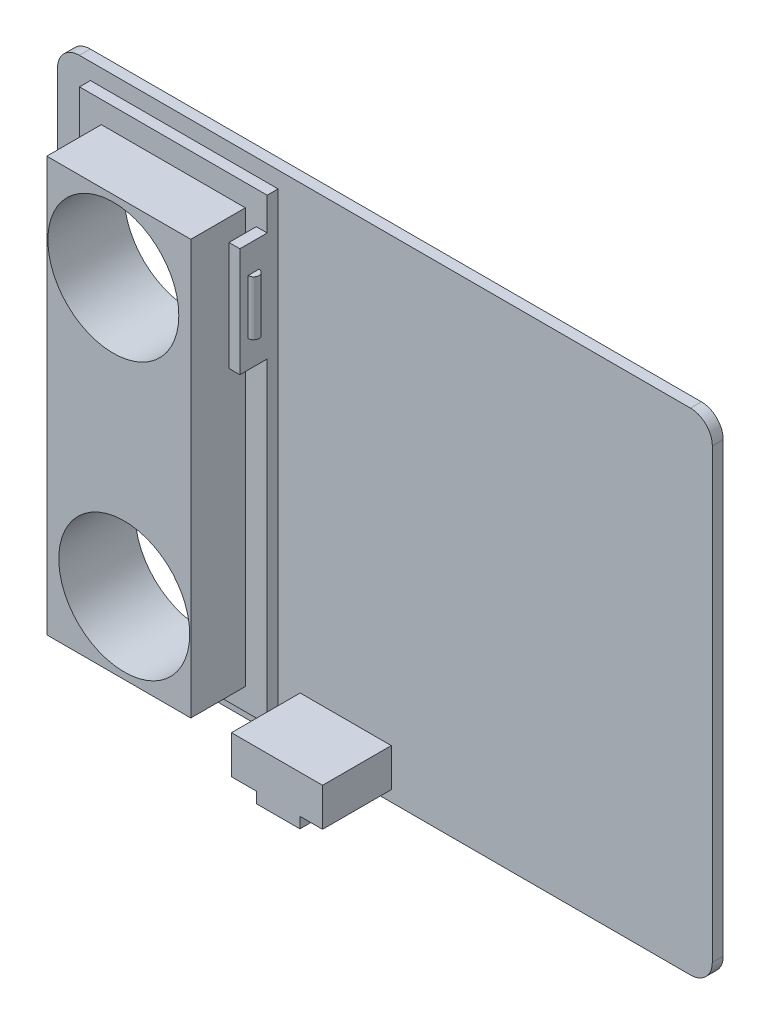
from build123d import *

# Parameters (mm, degrees)
SKETCH_1_W           = 17.2
SKETCH_1_H           = 42
SKETCH_1_W_2         = 13.2
SKETCH_1_H_2         = 38
EXTRUDE_1_DEPTH      = 1
SKETCH_2_W           = 1
SKETCH_2_H           = 10
EXTRUDE_2_DEPTH      = 2.5
EXTRUDE_3_DEPTH      = 2.5
EXTRUDE_3_DEPTH_BACK = 2.5
EXTRUDE_4_DEPTH      = 2.5
EXTRUDE_4_DEPTH_BACK = 2.5
SKETCH_5_W           = 60.014732212
SKETCH_5_H           = 45
EXTRUDE_5_DEPTH      = 1
FILLET_1_R           = 2
SKETCH_6_W           = 8.55
SKETCH_6_H           = 3.5
EXTRUDE_6_DEPTH      = 6.3
SKETCH_7_W           = 3.972075094
SKETCH_7_H           = 1
EXTRUDE_7_DEPTH      = 6.3
SKETCH_8_R           = 6
CUT_EXTRUDE_1_DEPTH  = 72.978746863
EXTRUDE_START        = 6
SKETCH_9_W           = 13.2
SKETCH_9_H           = 38
SKETCH_9_R           = 6
EXTRUDE_8_DEPTH      = 6
FILLET_2_R           = 0.15
SKETCH_10_W          = 6.3
SKETCH_10_H          = 3.5
CUT_EXTRUDE_2_DEPTH  = 0.2


with BuildPart() as part:
    # 草图1 → 凸台-拉伸1 (new body)
    with BuildSketch(Plane.XY):
        with Locations((8.6, 21)):
            Rectangle(SKETCH_1_W, SKETCH_1_H)
        with Locations((8.6, 21)):
            Rectangle(SKETCH_1_W_2, SKETCH_1_H_2, mode=Mode.SUBTRACT)
    extrude(amount=EXTRUDE_1_DEPTH)

    # 草图2 → 凸台-拉伸2 (add)
    with BuildSketch(Plane.XY.offset(1)):
        with Locations((16.7, 34)):
            Rectangle(SKETCH_2_W, SKETCH_2_H)
        with Locations((0.5, 8)):
            Rectangle(SKETCH_2_W, SKETCH_2_H)
    extrude(amount=EXTRUDE_2_DEPTH)

    # 草图3 → 凸台-拉伸3 (add, two sides: drawn at the far end of the back side and taken through both)
    with BuildSketch(Plane(origin=(0, 34, 0), x_dir=(-1, 0, 0), z_dir=(0, -1, 0)).offset(-EXTRUDE_3_DEPTH_BACK)):
        with BuildLine():
            Line((-17.2, -1.75), (-17.2, -2.75))
            ThreePointArc((-17.2, -2.75), (-17.7, -2.25), (-17.2, -1.75))
        make_face()
    extrude(amount=EXTRUDE_3_DEPTH + EXTRUDE_3_DEPTH_BACK)

    # 草图4 → 凸台-拉伸4 (add, two sides: drawn at the far end of the back side and taken through both)
    with BuildSketch(Plane(origin=(0, 8, 0), x_dir=(-1, 0, 0), z_dir=(0, -1, 0)).offset(-EXTRUDE_4_DEPTH_BACK)):
        with BuildLine():
            Line((0, -1.75), (0, -2.75))
            ThreePointArc((0, -2.75), (0.129409523, -2.732962913), (0.25, -2.683012702))
            Line((0.25, -2.683012702), (0.25, -1.816987298))
            ThreePointArc((0.25, -1.816987298), (0.129409523, -1.767037087), (0, -1.75))
        make_face()
    extrude(amount=EXTRUDE_4_DEPTH + EXTRUDE_4_DEPTH_BACK)

    # 草图5 → 凸台-拉伸5 (add)
    with BuildSketch(Plane(origin=(0, 0, 0), x_dir=(-1, 0, 0), z_dir=(0, 0, -1))):
        with Locations((-26.992633894, 21)):
            Rectangle(SKETCH_5_W, SKETCH_5_H)
    extrude(amount=EXTRUDE_5_DEPTH)

    # 圆角1
    fillet_1_edges = [part.edges().sort_by_distance(p)[0] for p in [
        (57, 43.5, -0.5),
        (57, -1.5, -0.5),
        (-3.014732212, -1.5, -0.5),
        (-3.014732212, 43.5, -0.5),
    ]]
    fillet(fillet_1_edges, radius=FILLET_1_R)

    # 草图6 → 凸台-拉伸6 (add)
    with BuildSketch(Plane.XY):
        with Locations((23.5, 1.25)):
            Rectangle(SKETCH_6_W, SKETCH_6_H)
    extrude(amount=EXTRUDE_6_DEPTH)

    # 草图7 → 凸台-拉伸7 (add)
    with BuildSketch(Plane.XY):
        with Locations((23.516201891, -1)):
            Rectangle(SKETCH_7_W, SKETCH_7_H)
    extrude(amount=EXTRUDE_7_DEPTH)

    # 草图8 → 切除-拉伸1 (cut, through all)
    with BuildSketch(Plane.XY):
        with Locations((9.1, 8.6)):
            Circle(SKETCH_8_R)
        with Locations((8.1, 33.4)):
            Circle(SKETCH_8_R)
    extrude(amount=-CUT_EXTRUDE_1_DEPTH, mode=Mode.SUBTRACT)

    # 草图9 → 凸台-拉伸8 (add)
    with BuildSketch(Plane.XY.offset(EXTRUDE_START)):
        with Locations((8.6, 21)):
            Rectangle(SKETCH_9_W, SKETCH_9_H)
        with Locations((9.1, 8.6)):
            Circle(SKETCH_9_R, mode=Mode.SUBTRACT)
        with Locations((8.1, 33.4)):
            Circle(SKETCH_9_R, mode=Mode.SUBTRACT)
    extrude(amount=-EXTRUDE_8_DEPTH)

    # 圆角2
    fillet_2_edges = [part.edges().sort_by_distance(p)[0] for p in [
        (-0.25, 8, 1.816987298),
        (-0.25, 8, 2.683012702),
    ]]
    fillet(fillet_2_edges, radius=FILLET_2_R)

    # 草图10 → 切除-拉伸2 (cut)
    with BuildSketch(Plane(origin=(27.775, 0, 0), x_dir=(0, 0, -1), z_dir=(1, 0, 0))):
        with Locations((-3.15, 1.25)):
            Rectangle(SKETCH_10_W, SKETCH_10_H)
    extrude(amount=-CUT_EXTRUDE_2_DEPTH, mode=Mode.SUBTRACT)


solid = part.part
